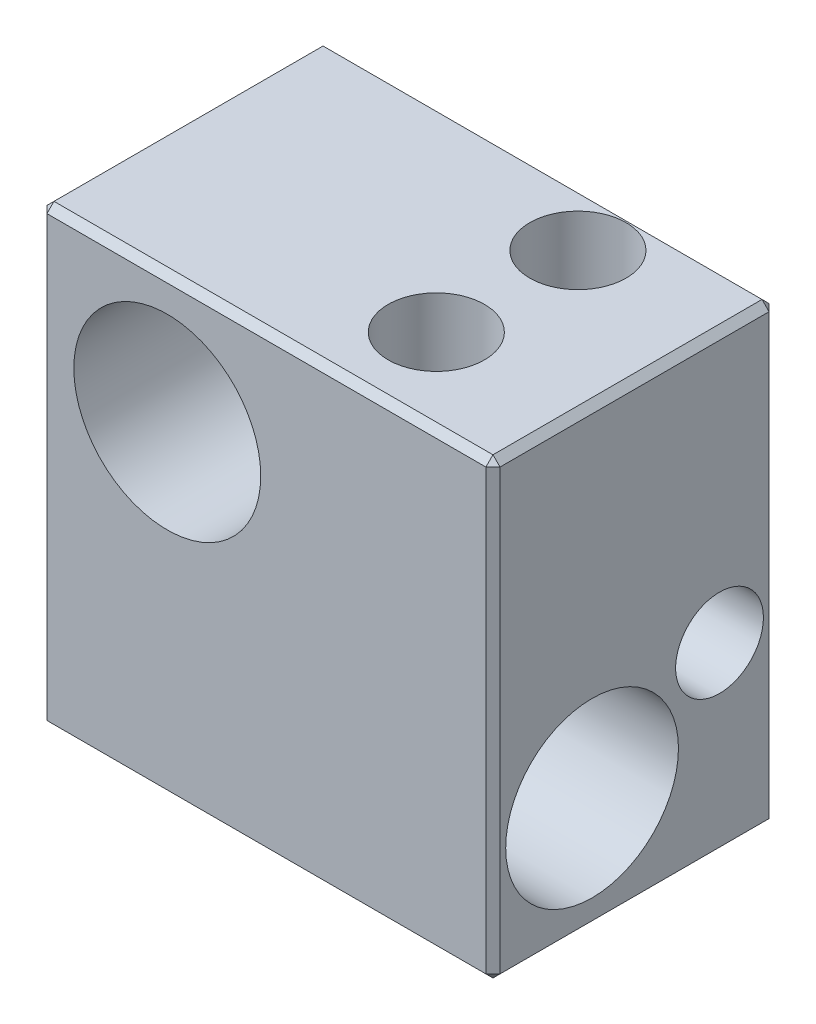
from build123d import *

# Parameters (mm, degrees)
ESQUISSE1_W                     = 16
ESQUISSE1_H                     = 16
BOSS_EXTRU_1_DEPTH              = 10
D_GAGEMENT_M61_D                = 6.6
DIAM_TRE_DU_PER_AGE_6_1_6_1_1_D = 6.1
DIAM_TRE_DU_PER_AGE_3_1_3_1_1_D = 3.1
D_GAGEMENT_M31_D                = 3.4
D_GAGEMENT_M31_DEPTH            = 11
D_GAGEMENT_M31_TIP              = 1.021463052
D_GAGEMENT_M32_D                = 3.4
D_GAGEMENT_M32_DEPTH            = 9.5
D_GAGEMENT_M32_TIP              = 1.021463052
CHANFREIN1_SIZE                 = 0.25


with BuildPart() as part:
    # Esquisse1 → Boss.-Extru.1 (new body)
    with BuildSketch(Plane.XY):
        with Locations((8, 8)):
            Rectangle(ESQUISSE1_W, ESQUISSE1_H)
    extrude(amount=BOSS_EXTRU_1_DEPTH)

    # Dégagement M61 (through all)
    with Locations(Plane.XY.offset(10)):
        with Locations((4.5, 11.5)):
            Hole(D_GAGEMENT_M61_D / 2)

    # Diamètre du perçage Ø6.1 (6.1)1 (through all)
    with Locations(Plane(origin=(16, 0, 0), x_dir=(0, 0, -1), z_dir=(1, 0, 0))):
        with Locations((-6.5, 4)):
            Hole(DIAM_TRE_DU_PER_AGE_6_1_6_1_1_D / 2)

    # Diamètre du perçage Ø3.1 (3.1)1 (through all)
    with Locations(Plane(origin=(16, 0, 0), x_dir=(0, 0, -1), z_dir=(1, 0, 0))):
        with Locations((-2, 6.5)):
            Hole(DIAM_TRE_DU_PER_AGE_3_1_3_1_1_D / 2)

    # Dégagement M31
    with Locations(Plane(origin=(0, 16, 0), x_dir=(1, 0, 0), z_dir=(0, 1, 0))):
        with Locations((11, -7)):
            Hole(D_GAGEMENT_M31_D / 2, depth=D_GAGEMENT_M31_DEPTH)
            with Locations((0, 0, -(D_GAGEMENT_M31_DEPTH + D_GAGEMENT_M31_TIP / 2))):  # 118° drill point
                Cone(0, D_GAGEMENT_M31_D / 2, D_GAGEMENT_M31_TIP, mode=Mode.SUBTRACT)

    # Dégagement M32
    with Locations(Plane(origin=(0, 16, 0), x_dir=(1, 0, 0), z_dir=(0, 1, 0))):
        with Locations((11, -2)):
            Hole(D_GAGEMENT_M32_D / 2, depth=D_GAGEMENT_M32_DEPTH)
            with Locations((0, 0, -(D_GAGEMENT_M32_DEPTH + D_GAGEMENT_M32_TIP / 2))):  # 118° drill point
                Cone(0, D_GAGEMENT_M32_D / 2, D_GAGEMENT_M32_TIP, mode=Mode.SUBTRACT)

    # Chanfrein1
    chanfrein1_edges = [part.edges().sort_by_distance(p)[0] for p in [
        (16, 8, 10),
        (8, 16, 10),
        (0, 8, 10),
        (8, 16, 0),
        (16, 8, 0),
        (8, 0, 0),
        (0, 8, 0),
        (8, 0, 10),
        (0, 16, 5),
        (16, 16, 5),
        (16, 0, 5),
        (0, 0, 5),
    ]]
    chamfer(chanfrein1_edges, length=CHANFREIN1_SIZE)


solid = part.part
